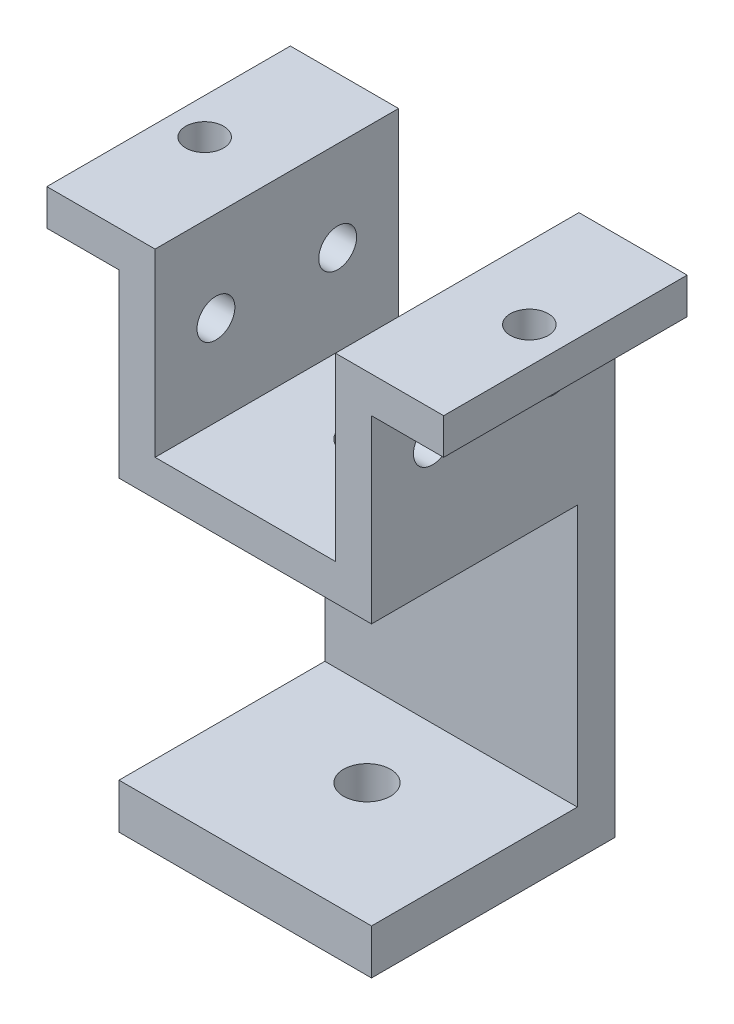
from build123d import *

# Parameters (mm, degrees)
BOSS_EXTRUDE1_DEPTH = 27
SKETCH2_R           = 2.1
CUT_EXTRUDE1_DEPTH  = 52
SKETCH3_R           = 2.1
CUT_EXTRUDE2_DEPTH  = 41.162171256
SKETCH5_W           = 28
SKETCH5_H           = 4.176671075
BOSS_EXTRUDE2_DEPTH = 34
SKETCH6_W           = 28
SKETCH6_H           = 5
BOSS_EXTRUDE3_DEPTH = 22.823328925
SKETCH7_R           = 2.6
CUT_EXTRUDE3_DEPTH  = 68.653529103


with BuildPart() as part:
    # Sketch1 → Boss-Extrude1 (new body)
    with BuildSketch(Plane.XY):
        Polygon((-14, 0), (14, 0), (14, 20), (22, 20), (22, 24), (10, 24), (10, 4), (-10, 4), (-10, 24), (-22, 24), (-22, 20), (-14, 20), align=None)
    extrude(amount=BOSS_EXTRUDE1_DEPTH)

    # Sketch2 → Cut-Extrude1 (cut, through all)
    with BuildSketch(Plane.ZY.offset(14)):
        with Locations(Location((6.75, 14, 0), (0, 0, 270))):
            Circle(SKETCH2_R)
        with Locations(Location((20.25, 14, 0), (0, 0, 270))):
            Circle(SKETCH2_R)
    extrude(amount=-CUT_EXTRUDE1_DEPTH, mode=Mode.SUBTRACT)

    # Sketch3 → Cut-Extrude2 (cut, through all)
    with BuildSketch(Plane.XZ.offset(-20)):
        with Locations(Location((-18, 13.5, 0), (0, 0, 270))):
            Circle(SKETCH3_R)
        with Locations(Location((18, 13.5, 0), (0, 0, 270))):
            Circle(SKETCH3_R)
    extrude(amount=-CUT_EXTRUDE2_DEPTH, mode=Mode.SUBTRACT)

    # Sketch5 → Boss-Extrude2 (add)
    with BuildSketch(Plane.XZ):
        with Locations((0, 2.088335538)):
            Rectangle(SKETCH5_W, SKETCH5_H)
    extrude(amount=BOSS_EXTRUDE2_DEPTH)

    # Sketch6 → Boss-Extrude3 (add)
    with BuildSketch(Plane.XY.offset(4.176671075)):
        with Locations((0, -31.5)):
            Rectangle(SKETCH6_W, SKETCH6_H)
    extrude(amount=BOSS_EXTRUDE3_DEPTH)

    # Sketch7 → Cut-Extrude3 (cut, through all)
    with BuildSketch(Plane.XZ.offset(34)):
        with Locations(Location((0, 13.5, 0), (0, 0, 270))):
            Circle(SKETCH7_R)
    extrude(amount=-CUT_EXTRUDE3_DEPTH, mode=Mode.SUBTRACT)


solid = part.part
